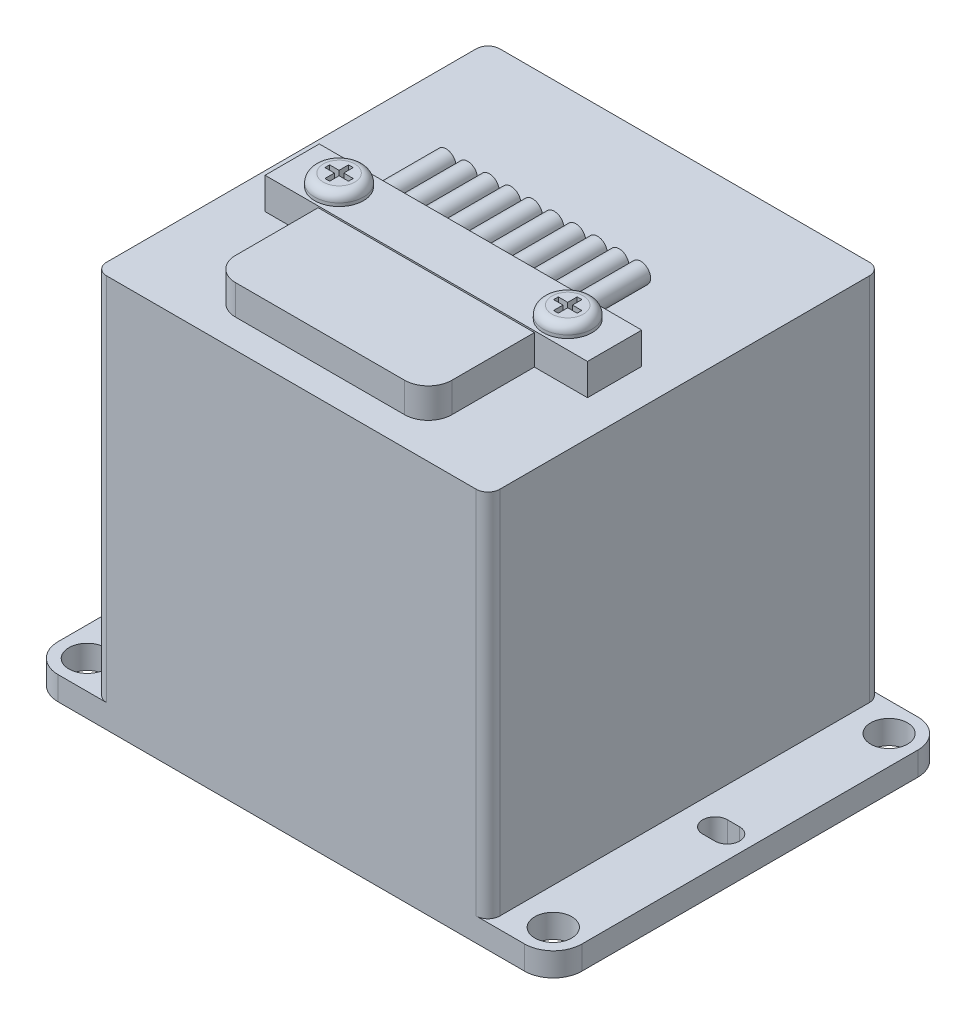
from build123d import *

# Parameters (mm, degrees)
SKETCH1_W           = 33.8328
SKETCH1_H           = 25.4
BOSS_EXTRUDE1_DEPTH = 1.524
FILLET1_R           = 1.8542
SKETCH2_R           = 1.1938
SKETCH2_R_2         = 0.8001
CUT_EXTRUDE1_DEPTH  = 1.524
SKETCH3_W           = 25.4
SKETCH3_H           = 25.4
BOSS_EXTRUDE2_DEPTH = 23.876
FILLET2_R           = 0.762
BOSS_EXTRUDE3_DEPTH = 2.032
SKETCH5_W           = 13.97
SKETCH5_H           = 6.858
BOSS_EXTRUDE4_DEPTH = 1.9304
FILLET3_R           = 1.524
SKETCH6_R           = 0.635
BOSS_EXTRUDE5_DEPTH = 4.064
SKETCH7_R           = 1.576094172
BOSS_EXTRUDE6_DEPTH = 0.762
FILLET4_R           = 0.5588
CUT_EXTRUDE2_DEPTH  = 0.762


with BuildPart() as part:
    # Sketch1 → Boss-Extrude1 (new body)
    with BuildSketch(Plane(origin=(0, 0, 0), x_dir=(1, 0, 0), z_dir=(0, 1, 0))):
        Rectangle(SKETCH1_W, SKETCH1_H)
    extrude(amount=BOSS_EXTRUDE1_DEPTH)

    # Fillet1
    fillet1_edges = [part.edges().sort_by_distance(p)[0] for p in [
        (16.9164, 0.762, 12.7),
        (-16.9164, 0.762, 12.7),
        (-16.9164, 0.762, -12.7),
        (16.9164, 0.762, -12.7),
    ]]
    fillet(fillet1_edges, radius=FILLET1_R)

    # Sketch2 → Cut-Extrude1 (cut)
    with BuildSketch(Plane(origin=(0, 1.524, 0), x_dir=(1, 0, 0), z_dir=(0, 1, 0))):
        with Locations(Location((15.0622, -10.8458, 0), (0, 0, 270))):
            Circle(SKETCH2_R)
        with Locations(Location((15.0622, 10.8458, 0), (0, 0, 270))):
            Circle(SKETCH2_R)
        with Locations(Location((-15.0368, 10.8458, 0), (0, 0, 270))):
            Circle(SKETCH2_R)
        with Locations(Location((-15.0368, -10.8458, 0), (0, 0, 270))):
            Circle(SKETCH2_R)
        with Locations(Location((-15.0368, 0, 0), (0, 0, 270))):
            Circle(SKETCH2_R_2)
        with BuildLine():
            Line((15.4559, -0.8001), (14.6685, -0.8001))
            ThreePointArc((14.6685, -0.8001), (13.8684, 0), (14.6685, 0.8001))
            Line((14.6685, 0.8001), (15.4559, 0.8001))
            ThreePointArc((15.4559, 0.8001), (16.256, 0), (15.4559, -0.8001))
        make_face()
    extrude(amount=-CUT_EXTRUDE1_DEPTH, mode=Mode.SUBTRACT)

    # Sketch3 → Boss-Extrude2 (add)
    with BuildSketch(Plane(origin=(0, 1.524, 0), x_dir=(1, 0, 0), z_dir=(0, 1, 0))):
        Rectangle(SKETCH3_W, SKETCH3_H)
    extrude(amount=BOSS_EXTRUDE2_DEPTH)

    # Fillet2
    fillet2_edges = [part.edges().sort_by_distance(p)[0] for p in [
        (12.7, 13.462, 12.7),
        (-12.7, 13.462, 12.7),
        (-12.7, 13.462, -12.7),
        (12.7, 13.462, -12.7),
    ]]
    fillet(fillet2_edges, radius=FILLET2_R)

    # Sketch4 → Boss-Extrude3 (add)
    with BuildSketch(Plane(origin=(0, 25.4, 0), x_dir=(1, 0, 0), z_dir=(0, 1, 0))):
        Polygon((0, -0.4826), (0, -3.9878), (6.985, -3.9878), (10.414, -3.9878), (10.414, -0.4826), align=None)
        Polygon((-6.985, -3.9878), (0, -3.9878), (0, -0.4826), (-10.414, -0.4826), (-10.414, -3.9878), align=None)
    extrude(amount=BOSS_EXTRUDE3_DEPTH)

    # Sketch5 → Boss-Extrude4 (add)
    with BuildSketch(Plane(origin=(0, 25.4, 0), x_dir=(1, 0, 0), z_dir=(0, 1, 0))):
        with Locations((0, -7.4168)):
            Rectangle(SKETCH5_W, SKETCH5_H)
    extrude(amount=BOSS_EXTRUDE4_DEPTH)

    # Fillet3
    fillet3_edges = [part.edges().sort_by_distance(p)[0] for p in [
        (6.985, 26.3652, 10.8458),
        (-6.985, 26.3652, 10.8458),
    ]]
    fillet(fillet3_edges, radius=FILLET3_R)

    # Sketch6 → Boss-Extrude5 (add)
    with BuildSketch(Plane(origin=(0, 0, 0.4826), x_dir=(-1, 0, 0), z_dir=(0, 0, -1))):
        with Locations(Location((-4.8895, 26.555352192, 0), (0, 0, 180))):
            Circle(SKETCH6_R)
        with Locations(Location((3.4925, 26.555352192, 0), (0, 0, 180))):
            Circle(SKETCH6_R)
        with Locations(Location((4.8895, 26.555352192, 0), (0, 0, 180))):
            Circle(SKETCH6_R)
        with Locations(Location((2.0955, 26.555352192, 0), (0, 0, 180))):
            Circle(SKETCH6_R)
        with Locations(Location((-2.0955, 26.555352192, 0), (0, 0, 180))):
            Circle(SKETCH6_R)
        with Locations(Location((0.6985, 26.555352192, 0), (0, 0, 180))):
            Circle(SKETCH6_R)
        with Locations(Location((-3.4925, 26.555352192, 0), (0, 0, 180))):
            Circle(SKETCH6_R)
        with Locations(Location((-0.6985, 26.555352192, 0), (0, 0, 180))):
            Circle(SKETCH6_R)
        with Locations(Location((-6.2865, 26.555352192, 0), (0, 0, 180))):
            Circle(SKETCH6_R)
        with Locations(Location((6.2865, 26.555352192, 0), (0, 0, 180))):
            Circle(SKETCH6_R)
    extrude(amount=BOSS_EXTRUDE5_DEPTH)

    # Sketch7 → Boss-Extrude6 (add)
    with BuildSketch(Plane(origin=(0, 27.432, 0), x_dir=(1, 0, 0), z_dir=(0, 1, 0))):
        with Locations(Location((7.385275371, -2.2352, 0), (0, 0, 90))):
            Circle(SKETCH7_R)
        with Locations(Location((-7.385275371, -2.2352, 0), (0, 0, 90))):
            Circle(SKETCH7_R)
    extrude(amount=BOSS_EXTRUDE6_DEPTH)

    # Fillet4
    fillet4_edges = [part.edges().sort_by_distance(p)[0] for p in [
        (7.385275371, 28.194, 3.811294172),
        (-7.385275371, 28.194, 3.811294172),
    ]]
    fillet(fillet4_edges, radius=FILLET4_R)

    # Sketch8 → Cut-Extrude2 (cut)
    with BuildSketch(Plane(origin=(0, 28.194, 0), x_dir=(1, 0, 0), z_dir=(0, 1, 0))):
        Polygon((7.537675371, -1.4732), (7.537675371, -2.0828), (8.147275371, -2.0828), (8.147275371, -2.3876), (7.537675371, -2.3876), (7.537675371, -2.9972), (7.232875371, -2.9972), (7.232875371, -2.3876), (6.623275371, -2.3876), (6.623275371, -2.0828), (7.232875371, -2.0828), (7.232875371, -1.4732), align=None)
        Polygon((-7.232875371, -2.3876), (-6.623275371, -2.3876), (-6.623275371, -2.0828), (-7.232875371, -2.0828), (-7.232875371, -1.4732), (-7.537675371, -1.4732), (-7.537675371, -2.0828), (-8.147275371, -2.0828), (-8.147275371, -2.3876), (-7.537675371, -2.3876), (-7.537675371, -2.9972), (-7.232875371, -2.9972), align=None)
    extrude(amount=-CUT_EXTRUDE2_DEPTH, mode=Mode.SUBTRACT)


solid = part.part
